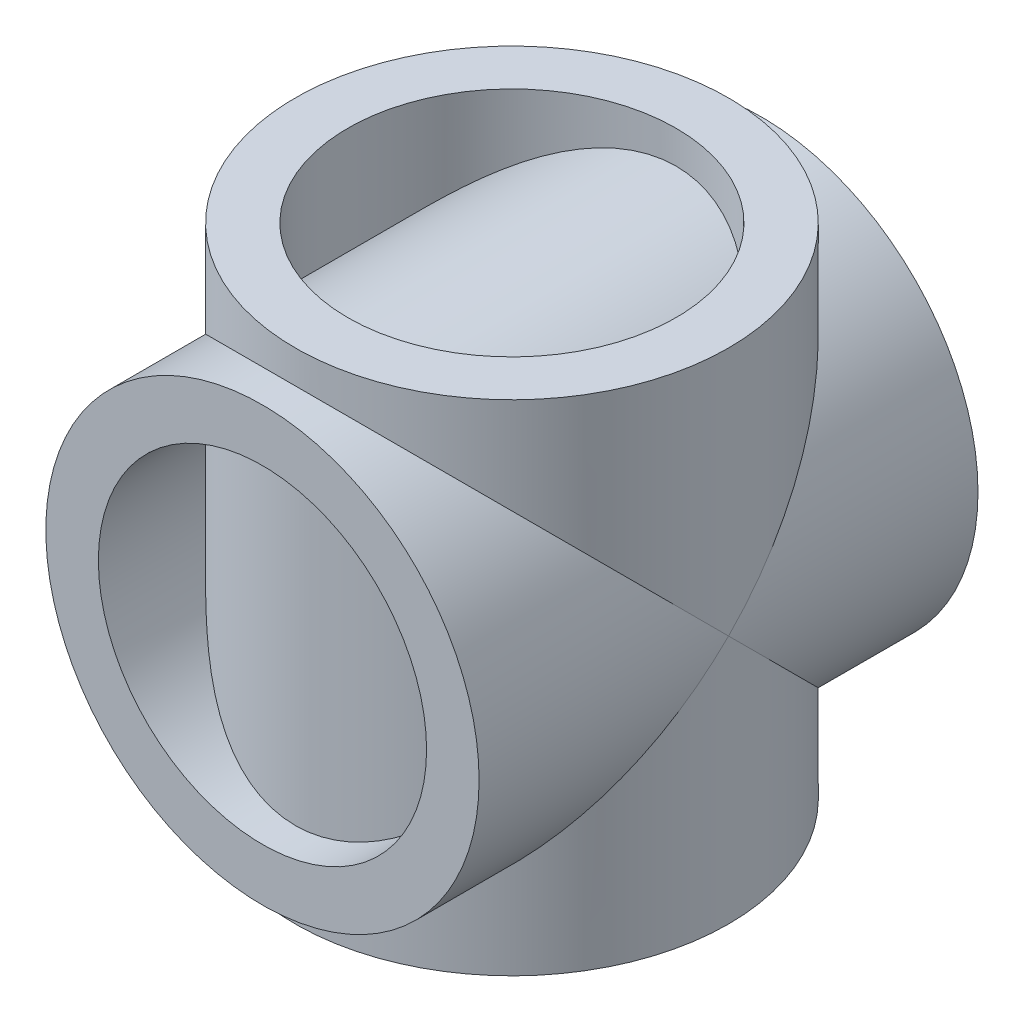
from build123d import *

# Parameters (mm, degrees)
SKETCH2_R           = 8.25
SKETCH2_R_2         = 6.25
EXTRUDE_THIN1_DEPTH = 19
SKETCH4_R           = 8.25
SKETCH4_R_2         = 6.25
EXTRUDE_THIN2_DEPTH = 9.5


with BuildPart() as part:
    # Sketch2 → Extrude-Thin1 (new body)
    with BuildSketch(Plane.XY):
        Circle(SKETCH2_R)
        Circle(SKETCH2_R_2, mode=Mode.SUBTRACT)
    extrude(amount=EXTRUDE_THIN1_DEPTH)

    # Sketch4 → Extrude-Thin2 (add, symmetric)
    with BuildSketch(Plane(origin=(0, 0, 0), x_dir=(1, 0, 0), z_dir=(0, 1, 0))):
        with Locations((0, -9.5)):
            Circle(SKETCH4_R)
        with Locations((0, -9.5)):
            Circle(SKETCH4_R_2, mode=Mode.SUBTRACT)
    extrude(amount=EXTRUDE_THIN2_DEPTH, both=True)


solid = part.part
